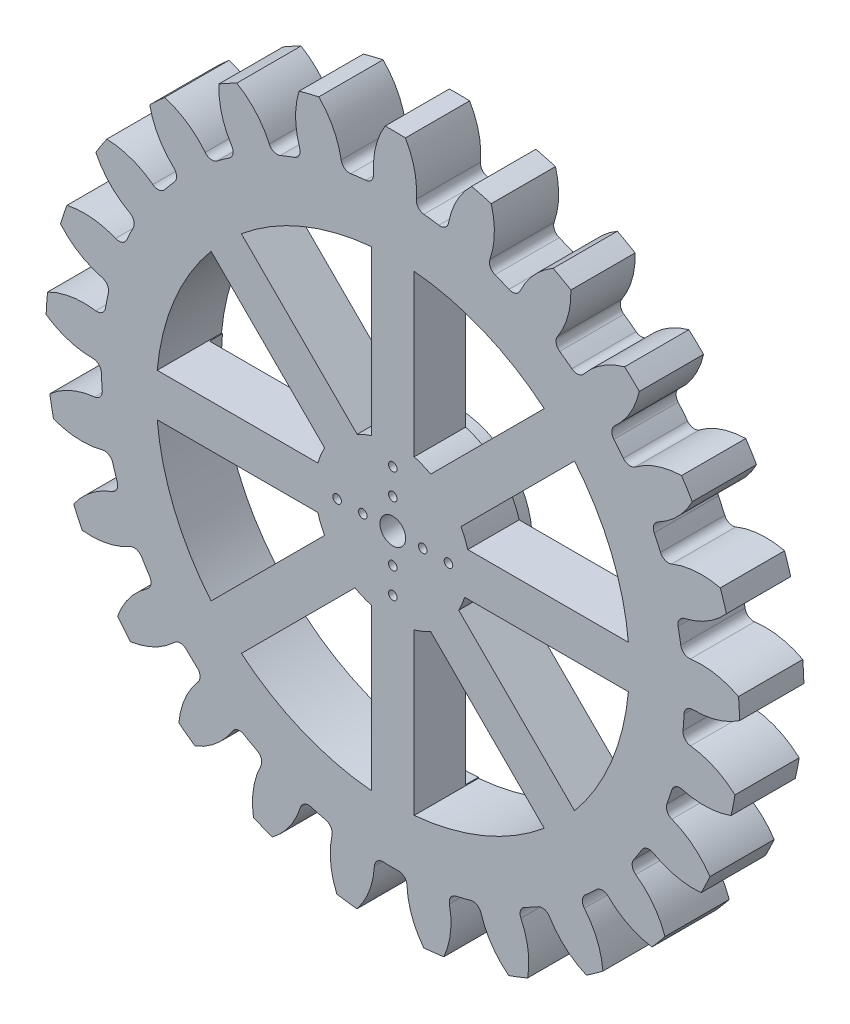
from build123d import *

# Parameters (mm, degrees)
SKETCH12_R               = 68.058
BOSS_EXTRUDE2_DEPTH      = 7.5
BOSS_EXTRUDE3_DEPTH      = 7.5
FILLET1_R                = 2
CIRPATTERN2_COUNT        = 25
FILLET1_OF_CIRPATTERN2_R = 2
CROQUIS1_R               = 1
CORTAR_EXTRUIR1_DEPTH    = 15
CROQUIS2_R               = 2
CORTAR_EXTRUIR2_DEPTH    = 15
SKETCH14_R               = 1
CUT_EXTRUDE1_DEPTH       = 15
CUT_EXTRUDE3_DEPTH       = 15
CUT_EXTRUDE4_DEPTH       = 15
SKETCH19_R               = 55
SKETCH19_R_2             = 17.5
CUT_EXTRUDE5_DEPTH       = 3
SKETCH20_R               = 3
CUT_EXTRUDE6_DEPTH       = 15


with BuildPart() as part:
    # Sketch12 → Boss-Extrude2 (new, symmetric)
    with BuildSketch(Plane.XY):
        Circle(SKETCH12_R)
    extrude(amount=BOSS_EXTRUDE2_DEPTH, both=True)

    # Sketch13 → Boss-Extrude3 (add, symmetric)
    with BuildSketch(Plane.XY):
        with BuildLine():
            ThreePointArc((-28.125648846, 61.974504766), (-32.366218452, 59.869184621), (-36.450160371, 57.474143516))
            ThreePointArc((-36.450160371, 57.474143516), (-39.675483485, 63.406008385), (-40.590482306, 70.095739857))
            ThreePointArc((-40.590482306, 70.095739857), (-38.521021696, 71.253988573), (-36.418540173, 72.351157086))
            ThreePointArc((-36.418540173, 72.351157086), (-31.322395625, 67.921818449), (-28.125648846, 61.974504766))
        make_face()
    boss_extrude3 = extrude(amount=BOSS_EXTRUDE3_DEPTH, both=True)

    # Fillet1
    fillet1_edges = [part.edges().sort_by_distance(p)[0] for p in [
        (-28.125648846, 61.974504766, 0),
        (-36.450160371, 57.474143516, 0),
    ]]
    fillet(fillet1_edges, radius=FILLET1_R)

    # CirPattern2: Boss-Extrude3 ×25 about axis
    cirpattern2_axis = Axis((0, 0, 0), (0, 0, 1))
    for i in range(1, CIRPATTERN2_COUNT):
        add(boss_extrude3.rotate(cirpattern2_axis, i * 360 / CIRPATTERN2_COUNT))

    # Fillet1 of CirPattern2
    fillet1_of_cirpattern2_edges = [part.edges().sort_by_distance(p)[0] for p in [
        (-42.654462466, 53.032897297, 0),
        (-49.598249822, 46.60370134, 0),
        (-54.503139336, 40.75903785, 0),
        (-59.629898827, 32.804977213, 0),
        (-62.927183514, 25.924138154, 0),
        (-65.914781985, 16.944995719, 0),
        (-67.397281321, 9.460329515, 0),
        (-68.057996973, 0.020297824, 0),
        (-67.632560073, -7.59790642, 0),
        (-65.924877712, -16.905675457, 0),
        (-63.618236341, -24.178737951, 0),
        (-59.649455929, -32.769402975, 0),
        (-55.606544847, -39.240330454, 0),
        (-49.626039455, -46.574108386, 0),
        (-44.100889635, -51.836308679, 0),
        (-36.484436411, -57.45239128, 0),
        (-29.824213335, -61.175220988, 0),
        (-21.050382046, -64.720729135, 0),
        (-13.673572025, -66.670269177, 0),
        (-4.293654759, -67.922425552, 0),
        (3.336230103, -67.976179156, 0),
        (12.732858647, -66.85630617, 0),
        (20.136404624, -65.010895801, 0),
        (28.959319716, -61.589359191, 0),
        (35.671334785, -57.960738769, 0),
        (43.366160223, -52.452526265, 0),
        (48.964903793, -47.268695355, 0),
        (55.048145393, -40.019908206, 0),
        (59.181827814, -33.60658597, 0),
        (63.271253135, -25.072692132, 0),
        (65.680139938, -17.832851193, 0),
        (67.518795347, -8.5500666, 0),
        (68.051527316, -0.93861279, 0),
        (67.523883331, 8.509791061, 0),
        (66.146986956, 16.014602106, 0),
        (63.28619739, 25.034947253, 0),
        (60.086188134, 31.961560655, 0),
        (55.072006916, 39.987065637, 0),
        (50.24995313, 45.900256801, 0),
        (43.397439707, 52.426649624, 0),
        (37.256328765, 56.954871003, 0),
        (28.996051757, 61.572074405, 0),
        (21.921752244, 64.430801194, 0),
        (12.772735235, 66.848699304, 0),
        (5.209751407, 67.858307187, 0),
        (-4.253139217, 67.924974573, 0),
        (-11.829597271, 67.022026174, 0),
        (-21.01177329, 64.73327388, 0),
    ]]
    fillet(fillet1_of_cirpattern2_edges, radius=FILLET1_OF_CIRPATTERN2_R)

    # Croquis1 → Cortar-Extruir1 (cut)
    with BuildSketch(Plane(origin=(0, 0, -7.5), x_dir=(-1, 0, 0), z_dir=(0, 0, -1))):
        with Locations((7, 0)):
            Circle(CROQUIS1_R)
        with Locations((13, 0)):
            Circle(CROQUIS1_R)
        with Locations((-7, 0)):
            Circle(CROQUIS1_R)
        with Locations((-13, 0)):
            Circle(CROQUIS1_R)
    extrude(amount=-CORTAR_EXTRUIR1_DEPTH, mode=Mode.SUBTRACT)

    # Croquis2 → Cortar-Extruir2 (cut)
    with BuildSketch(Plane(origin=(0, 0, -7.5), x_dir=(-1, 0, 0), z_dir=(0, 0, -1))):
        Circle(CROQUIS2_R)
    extrude(amount=-CORTAR_EXTRUIR2_DEPTH, mode=Mode.SUBTRACT)

    # Sketch14 → Cut-Extrude1 (cut)
    with BuildSketch(Plane(origin=(0, 0, -7.5), x_dir=(-1, 0, 0), z_dir=(0, 0, -1))):
        with Locations((0, 7)):
            Circle(SKETCH14_R)
        with Locations((0, 13)):
            Circle(SKETCH14_R)
        with Locations((0, -7)):
            Circle(SKETCH14_R)
        with Locations((0, -13)):
            Circle(SKETCH14_R)
    extrude(amount=-CUT_EXTRUDE1_DEPTH, mode=Mode.SUBTRACT)

    # Sketch15 → Cut-Extrude3 (cut)
    with BuildSketch(Plane(origin=(0, 0, -7.5), x_dir=(-1, 0, 0), z_dir=(0, 0, -1))):
        with BuildLine():
            ThreePointArc((42.426406871, 35.355339059), (51.022914865, 21.134383329), (55, 5))
            Line((55, 5), (17.5, 5))
            ThreePointArc((17.5, 5), (16.814861303, 6.964943601), (15.909902577, 8.838834765))
            Line((15.909902577, 8.838834765), (42.426406871, 35.355339059))
        make_face()
        with BuildLine():
            Line((-5, 17.5), (-5, 55))
            ThreePointArc((-5, 55), (-21.134383329, 51.022914865), (-35.355339059, 42.426406871))
            Line((-35.355339059, 42.426406871), (-8.838834765, 15.909902577))
            ThreePointArc((-8.838834765, 15.909902577), (-6.964943601, 16.814861303), (-5, 17.5))
        make_face()
        with BuildLine():
            Line((-15.909902577, 8.838834765), (-42.426406871, 35.355339059))
            ThreePointArc((-42.426406871, 35.355339059), (-51.022914865, 21.134383329), (-55, 5))
            Line((-55, 5), (-17.5, 5))
            ThreePointArc((-17.5, 5), (-16.814861303, 6.964943601), (-15.909902577, 8.838834765))
        make_face()
        with BuildLine():
            Line((-8.838834765, -15.909902577), (-35.355339059, -42.426406871))
            ThreePointArc((-35.355339059, -42.426406871), (-21.134383329, -51.022914865), (-5, -55))
            Line((-5, -55), (-5, -17.5))
            ThreePointArc((-5, -17.5), (-6.964943601, -16.814861303), (-8.838834765, -15.909902577))
        make_face()
        with BuildLine():
            Line((5, -17.5), (5, -55))
            ThreePointArc((5, -55), (21.134383329, -51.022914865), (35.355339059, -42.426406871))
            Line((35.355339059, -42.426406871), (8.838834765, -15.909902577))
            ThreePointArc((8.838834765, -15.909902577), (6.964943601, -16.814861303), (5, -17.5))
        make_face()
        with BuildLine():
            Line((15.909902577, -8.838834765), (42.426406871, -35.355339059))
            ThreePointArc((42.426406871, -35.355339059), (51.022914865, -21.134383329), (55, -5))
            Line((55, -5), (17.5, -5))
            ThreePointArc((17.5, -5), (16.814861303, -6.964943601), (15.909902577, -8.838834765))
        make_face()
    extrude(amount=-CUT_EXTRUDE3_DEPTH, mode=Mode.SUBTRACT)

    # Sketch18 → Cut-Extrude4 (cut)
    with BuildSketch(Plane(origin=(0, 0, -7.5), x_dir=(-1, 0, 0), z_dir=(0, 0, -1))):
        with BuildLine():
            Line((5, 16.770509831), (5, 55))
            ThreePointArc((5, 55), (21.134383329, 51.022914865), (35.355339059, 42.426406871))
            Line((35.355339059, 42.426406871), (8.32300732, 15.394075132))
            ThreePointArc((8.32300732, 15.394075132), (6.696960066, 16.167891819), (5, 16.770509831))
        make_face()
        with BuildLine():
            Line((-16.770509831, -5), (-55, -5))
            ThreePointArc((-55, -5), (-51.022914865, -21.134383329), (-42.426406871, -35.355339059))
            Line((-42.426406871, -35.355339059), (-15.394075132, -8.32300732))
            ThreePointArc((-15.394075132, -8.32300732), (-16.167891819, -6.696960066), (-16.770509831, -5))
        make_face()
    extrude(amount=-CUT_EXTRUDE4_DEPTH, mode=Mode.SUBTRACT)

    # Sketch19 → Cut-Extrude5 (cut)
    with BuildSketch(Plane(origin=(0, 0, -7.5), x_dir=(-1, 0, 0), z_dir=(0, 0, -1))):
        Circle(SKETCH19_R)
        Circle(SKETCH19_R_2, mode=Mode.SUBTRACT)
    extrude(amount=-CUT_EXTRUDE5_DEPTH, mode=Mode.SUBTRACT)

    # Sketch20 → Cut-Extrude6 (cut)
    with BuildSketch(Plane.XY.offset(7.5)):
        Circle(SKETCH20_R)
    extrude(amount=-CUT_EXTRUDE6_DEPTH, mode=Mode.SUBTRACT)


solid = part.part
